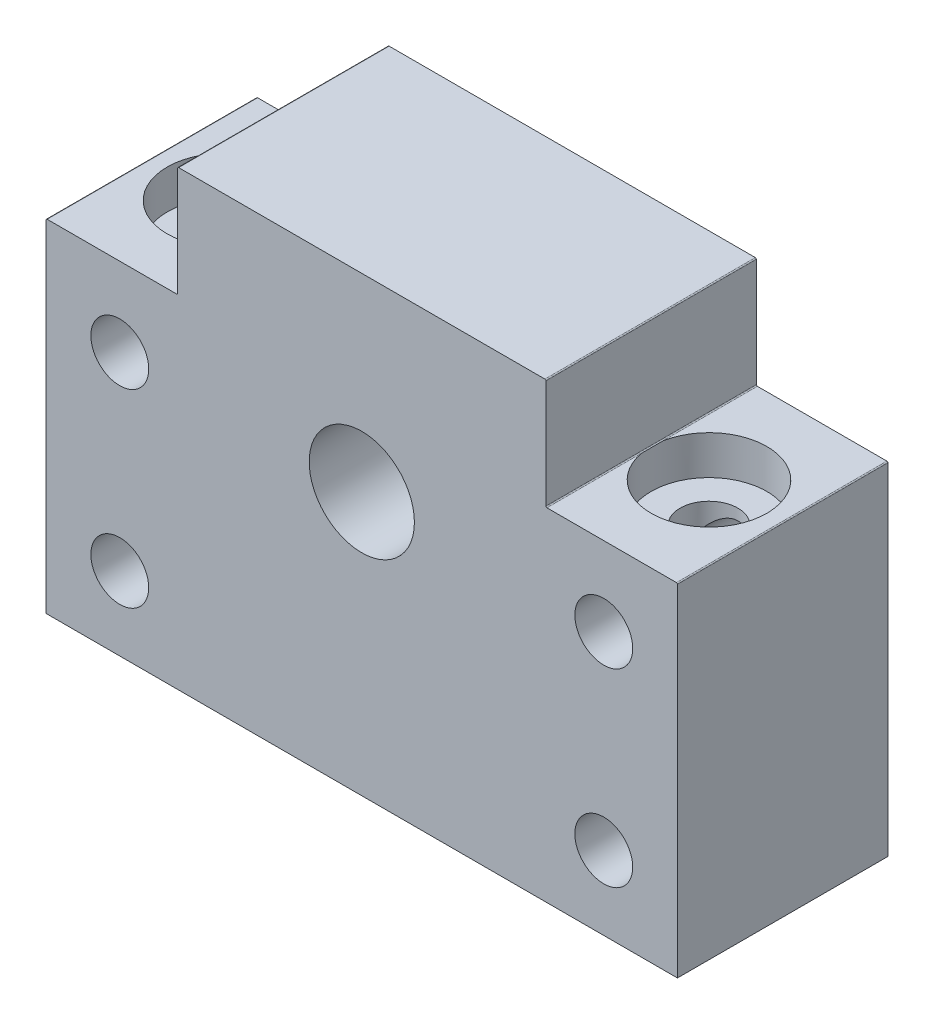
from build123d import *

# Parameters (mm, degrees)
SKETCH_1_W                  = 60
SKETCH_1_H                  = 32.5
EXTRUDE_1_DEPTH             = 20
SKETCH_2_W                  = 35
SKETCH_2_H                  = 20
EXTRUDE_2_DEPTH             = 10.5
FILLET_1_R                  = 0.1
SKETCH_3_R                  = 5
SKETCH_3_R_2                = 2.75
CUT_EXTRUDE_1_DEPTH         = 45.895016427
HOLE_WIZARD_M5_1_AT_2_COUNT = 2
HOLE_WIZARD_M5_1_AT_2_PITCH = 46


with BuildPart() as part:
    # 스케치1 → 보스-돌출1 (new body)
    with BuildSketch(Plane.XY):
        Rectangle(SKETCH_1_W, SKETCH_1_H)
    extrude(amount=EXTRUDE_1_DEPTH)

    # 스케치2 → 보스-돌출2 (add)
    with BuildSketch(Plane(origin=(0, 16.25, 0), x_dir=(1, 0, 0), z_dir=(0, 1, 0))):
        with Locations((0, -10)):
            Rectangle(SKETCH_2_W, SKETCH_2_H)
    extrude(amount=EXTRUDE_2_DEPTH)

    # 필렛1
    fillet_1_edges = [part.edges().sort_by_distance(p)[0] for p in [
        (17.5, 16.25, 10),
        (-17.5, 16.25, 10),
        (17.5, 26.75, 10),
        (-17.5, 26.75, 10),
        (-30, 16.25, 10),
        (30, 16.25, 10),
    ]]
    fillet(fillet_1_edges, radius=FILLET_1_R)

    # 스케치3 → 컷-돌출1 (cut, through all)
    with BuildSketch(Plane.XY.offset(20)):
        with Locations((0, 8.75)):
            Circle(SKETCH_3_R)
        with Locations((-23, 8.75)):
            Circle(SKETCH_3_R_2)
        with Locations((-23, -9.25)):
            Circle(SKETCH_3_R_2)
        with Locations((23, 8.75)):
            Circle(SKETCH_3_R_2)
        with Locations((23, -9.25)):
            Circle(SKETCH_3_R_2)
    extrude(amount=-CUT_EXTRUDE_1_DEPTH, mode=Mode.SUBTRACT)

    # 스케치7 → M5 남비 머리 나사용 카운터보어1 (revolve, cut)
    with BuildSketch(Plane(origin=(23, 16.25, 10), x_dir=(0, 0, 1), z_dir=(1, 0, 0))):
        Polygon((0, 0), (0, 41.652366702), (2.75, 40), (2.75, 3.7), (5.5, 3.7), (5.5, 0), align=None)
    hole_wizard_m5_1 = revolve(axis=Axis((23, 22.6, 10), (0, -1, 0)), mode=Mode.SUBTRACT)

    # M5 남비 머리 나사용 카운터보어1 at 2: M5 남비 머리 나사용 카운터보어1 ×2
    with Locations(*[(-i * HOLE_WIZARD_M5_1_AT_2_PITCH, 0, 0) for i in range(1, HOLE_WIZARD_M5_1_AT_2_COUNT)]):
        add(hole_wizard_m5_1, mode=Mode.SUBTRACT)


solid = part.part
